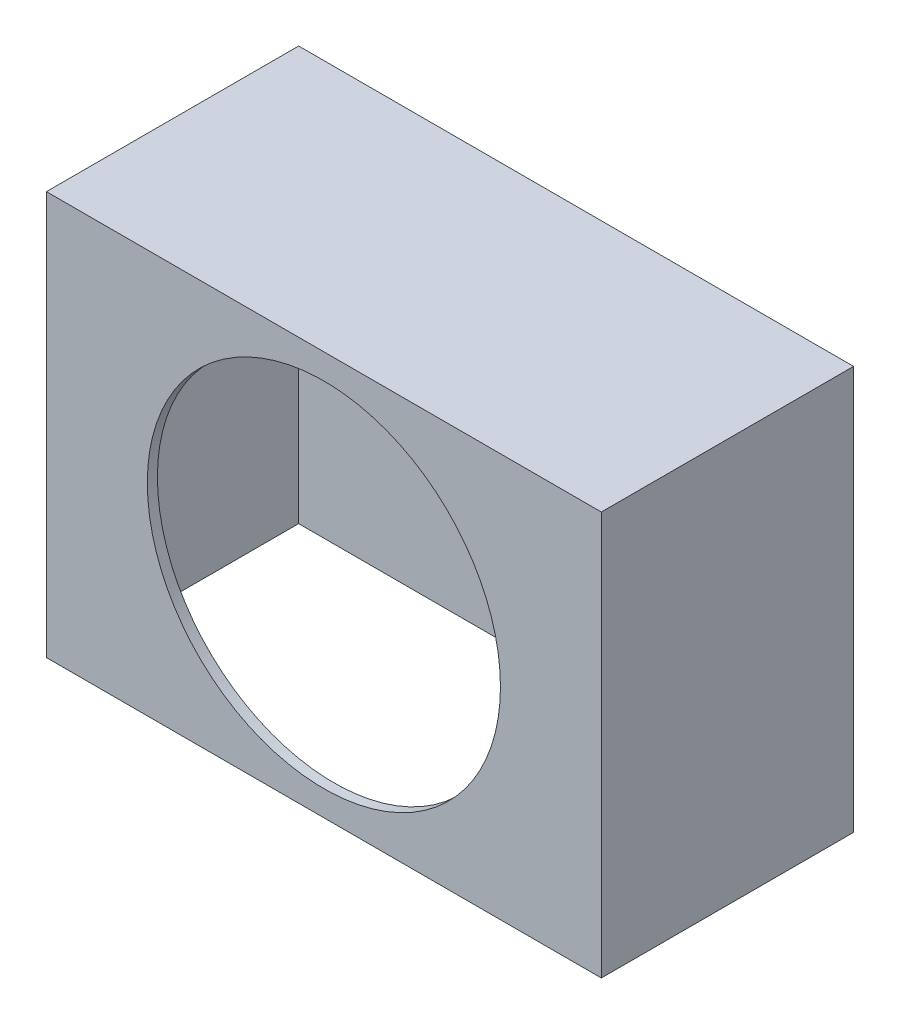
from build123d import *

# Parameters (mm, degrees)
SKETCH_1_W          = 110
SKETCH_1_H          = 50
EXTRUDE_1_DEPTH     = 80
SHELL_1_T           = -2
SKETCH_2_R          = 35
CUT_EXTRUDE_1_DEPTH = 2


with BuildPart() as part:
    # 草图1 → 凸台-拉伸1 (new body)
    with BuildSketch(Plane(origin=(0, 0, 0), x_dir=(1, 0, 0), z_dir=(0, 1, 0))):
        Rectangle(SKETCH_1_W, SKETCH_1_H)
    extrude(amount=EXTRUDE_1_DEPTH)

    # 抽壳1
    shell_1_openings = [part.faces().sort_by_distance(p)[0] for p in [
        (0, 0, 0),
    ]]
    offset(amount=SHELL_1_T, openings=shell_1_openings, kind=Kind.INTERSECTION)

    # 草图2 → 切除-拉伸1 (cut)
    with BuildSketch(Plane.XY.offset(25)):
        with Locations((0, 40)):
            Circle(SKETCH_2_R)
    extrude(amount=-CUT_EXTRUDE_1_DEPTH, mode=Mode.SUBTRACT)


solid = part.part
